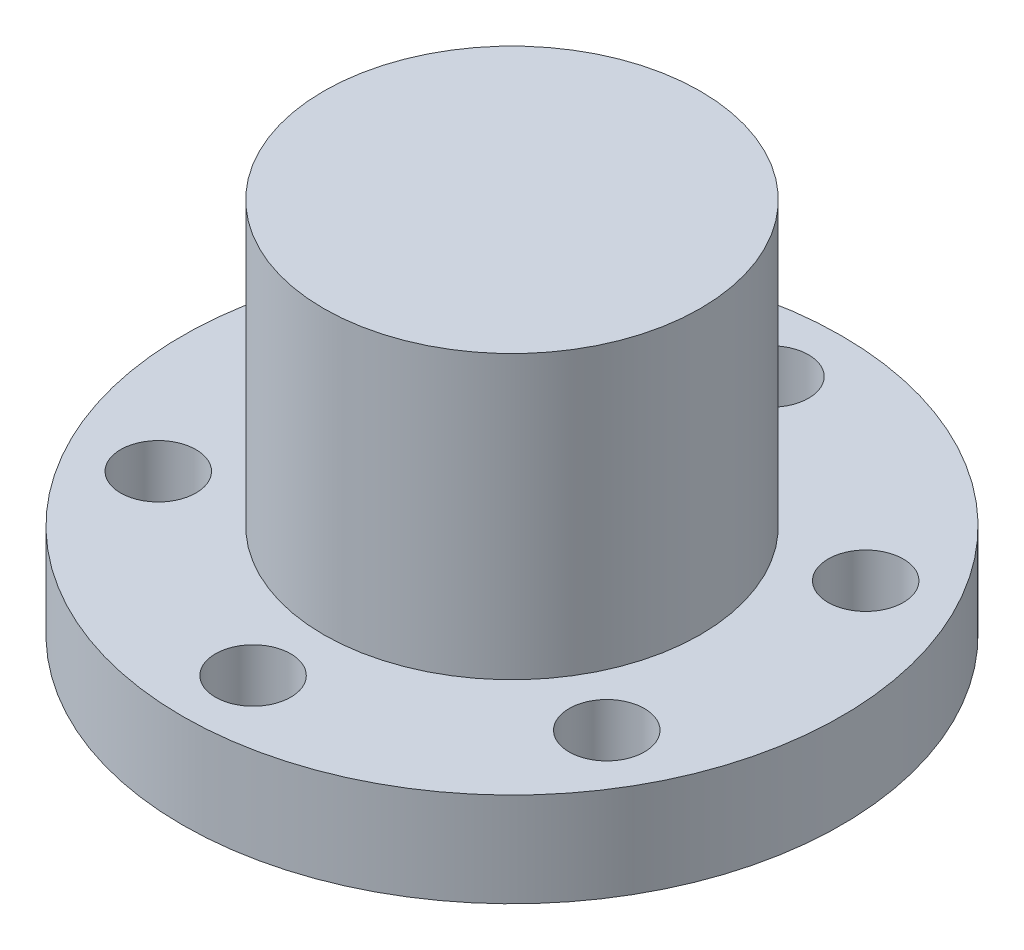
from build123d import *

# Parameters (mm, degrees)
SKETCH2_R           = 17.5
SKETCH2_R_2         = 2
BOSS_EXTRUDE1_DEPTH = 5
SKETCH3_R           = 10
BOSS_EXTRUDE2_DEPTH = 15


with BuildPart() as part:
    # Sketch2 → Boss-Extrude1 (new body)
    with BuildSketch(Plane(origin=(0, 0, 0), x_dir=(1, 0, 0), z_dir=(0, 1, 0))):
        with Locations(Location((0, 0, 0), (0, 0, 270))):
            Circle(SKETCH2_R)
        with Locations(Location((0, 13.75, 0), (0, 0, 270))):
            Circle(SKETCH2_R_2, mode=Mode.SUBTRACT)
        with Locations(Location((11.907849302, 6.875, 0), (0, 0, 270))):
            Circle(SKETCH2_R_2, mode=Mode.SUBTRACT)
        with Locations(Location((11.907849302, -6.875, 0), (0, 0, 270))):
            Circle(SKETCH2_R_2, mode=Mode.SUBTRACT)
        with Locations(Location((0, -13.75, 0), (0, 0, 270))):
            Circle(SKETCH2_R_2, mode=Mode.SUBTRACT)
        with Locations(Location((-11.907849302, -6.875, 0), (0, 0, 270))):
            Circle(SKETCH2_R_2, mode=Mode.SUBTRACT)
        with Locations(Location((-11.907849302, 6.875, 0), (0, 0, 270))):
            Circle(SKETCH2_R_2, mode=Mode.SUBTRACT)
    extrude(amount=BOSS_EXTRUDE1_DEPTH)

    # Sketch3 → Boss-Extrude2 (add)
    with BuildSketch(Plane(origin=(0, 5, 0), x_dir=(1, 0, 0), z_dir=(0, 1, 0))):
        with Locations(Location((0, 0, 0), (0, 0, 270))):
            Circle(SKETCH3_R)
    extrude(amount=BOSS_EXTRUDE2_DEPTH)


solid = part.part
